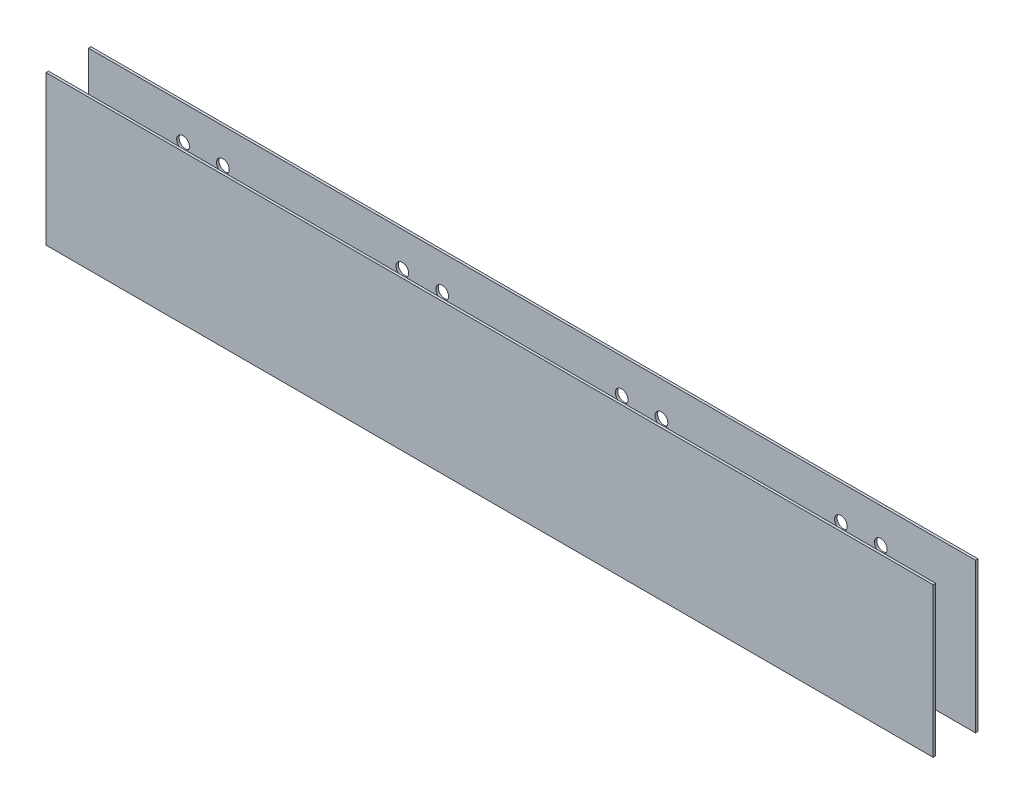
from build123d import *

# Parameters (mm, degrees)
SKETCH1_W               = 1780
SKETCH1_H               = 5
BOSS_EXTRUDE1_DEPTH     = 150
BOSS_EXTRUDE1_2_DEPTH   = 150
CUT_EXTRUDE1_DEPTH      = 39
CUT_EXTRUDE1_DEPTH_BACK = 33
CUT_EXTRUDE1_START      = -85
SKETCH2_R               = 12.75


with BuildPart() as part:
    # Sketch1 → Boss-Extrude1 (new, symmetric)
    with BuildSketch(Plane(origin=(0, 0, 0), x_dir=(1, 0, 0), z_dir=(0, 1, 0))):
        with Locations((0, 42.5)):
            Rectangle(SKETCH1_W, SKETCH1_H)
    extrude(amount=BOSS_EXTRUDE1_DEPTH, both=True)

    # Sketch2 → Cut-Extrude1 (cut, two sides: drawn at the far end of the back side and taken through both)
    with BuildSketch(Plane.XY.offset(45).offset(CUT_EXTRUDE1_START - CUT_EXTRUDE1_DEPTH_BACK)):
        with Locations(Location((-700.1, 80, 0), (0, 0, 180))):
            Circle(SKETCH2_R)
        with Locations(Location((-620.1, 80, 0), (0, 0, 180))):
            Circle(SKETCH2_R)
        with Locations(Location((-260.1, 80, 0), (0, 0, 180))):
            Circle(SKETCH2_R)
        with Locations(Location((-180.1, 80, 0), (0, 0, 180))):
            Circle(SKETCH2_R)
        with Locations(Location((179.9, 80, 0), (0, 0, 180))):
            Circle(SKETCH2_R)
        with Locations(Location((259.9, 80, 0), (0, 0, 180))):
            Circle(SKETCH2_R)
        with Locations(Location((619.9, 80, 0), (0, 0, 180))):
            Circle(SKETCH2_R)
        with Locations(Location((699.9, 80, 0), (0, 0, 180))):
            Circle(SKETCH2_R)
    extrude(amount=CUT_EXTRUDE1_DEPTH + CUT_EXTRUDE1_DEPTH_BACK, mode=Mode.SUBTRACT)


with BuildPart() as body_2:
    # Sketch1 → Boss-Extrude1 2 (new, symmetric)
    with BuildSketch(Plane(origin=(0, 0, 0), x_dir=(1, 0, 0), z_dir=(0, 1, 0))):
        with Locations((0, -42.5)):
            Rectangle(SKETCH1_W, SKETCH1_H)
    extrude(amount=BOSS_EXTRUDE1_2_DEPTH, both=True)


solid = Compound([part.part, body_2.part])
